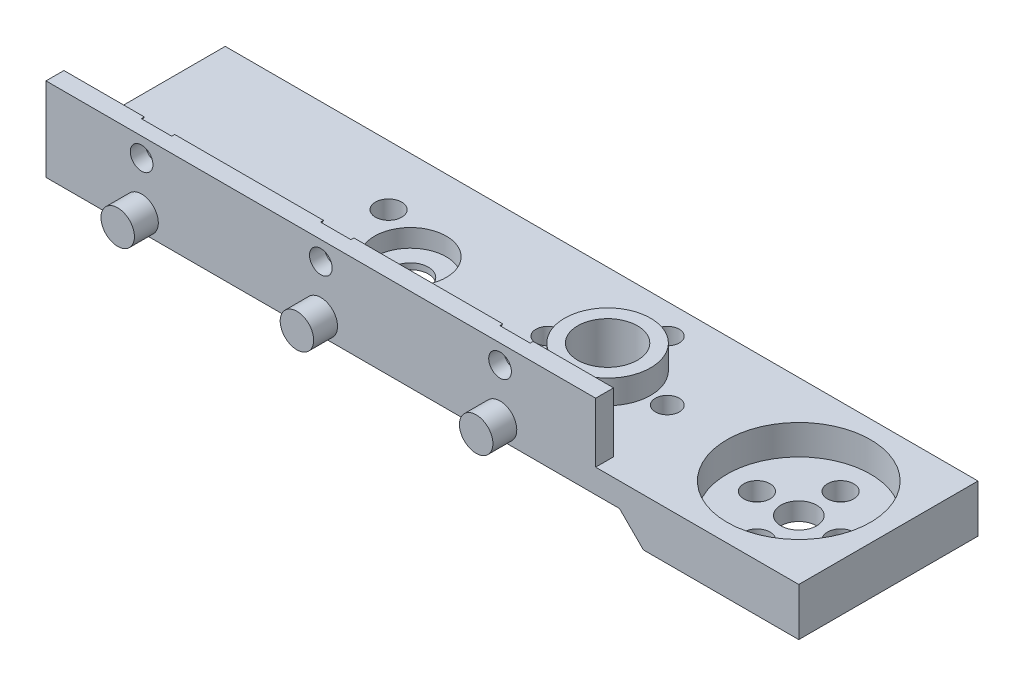
from build123d import *

# Parameters (mm, degrees)
SKETCH_1_W               = 48
SKETCH_1_H               = 15
SKETCH_1_R               = 1.1
SKETCH_1_R_2             = 1
SKETCH_1_R_3             = 1.5
SKETCH_1_R_4             = 2.5
EXTRUDE_1_DEPTH          = 2
EXTRUDE_2_DEPTH          = 2
SKETCH_4_R               = 3
CUT_EXTRUDE_1_DEPTH      = 1.5
SKETCH_5_W               = 46
SKETCH_5_H               = 1.5
EXTRUDE_3_DEPTH          = 5
SKETCH_2_3_R             = 0.95
CUT_EXTRUDE_2_DEPTH      = 6
CUT_EXTRUDE_START        = -0.25
SKETCH_7_R               = 0.95
CUT_EXTRUDE_3_DEPTH      = 0.25
SKETCH_1_3_W             = 15
SKETCH_1_3_H             = 15
SKETCH_1_3_R             = 6
SKETCH_1_3_R_2           = 1.5
SKETCH_1_3_R_3           = 1.1
EXTRUDE_4_DEPTH          = 2
EXTRUDE_START            = -2
SKETCH_1_4_W             = 15
SKETCH_1_4_H             = 15
SKETCH_1_4_R             = 6
SKETCH_1_4_R_2           = 1.5
SKETCH_1_4_R_3           = 1.1
EXTRUDE_5_DEPTH          = 2
CUT_EXTRUDE_4_DEPTH      = 2
CUT_EXTRUDE_4_DEPTH_BACK = 0.5
SKETCH_1_5_R             = 6
CUT_EXTRUDE_5_DEPTH      = 15
SKETCH_9_R               = 3.6
SKETCH_9_R_2             = 2.5
EXTRUDE_6_DEPTH          = 2


with BuildPart() as part:
    # 草图1 → 凸台-拉伸1 (new body)
    with BuildSketch(Plane(origin=(0, 0, 0), x_dir=(1, 0, 0), z_dir=(0, 1, 0))):
        with Locations((-7.5, 0)):
            Rectangle(SKETCH_1_W, SKETCH_1_H)
        with Locations(Location((-4.169872981, -2.5, 0), (0, 0, 270))):
            Circle(SKETCH_1_R, mode=Mode.SUBTRACT)
        with Locations(Location((3, 0, 0), (0, 0, 270))):
            Circle(SKETCH_1_R_2, mode=Mode.SUBTRACT)
        with Locations(Location((-8.5, 0, 0), (0, 0, 270))):
            Circle(SKETCH_1_R_3, mode=Mode.SUBTRACT)
        with Locations(Location((-12.830127019, 2.5, 0), (0, 0, 270))):
            Circle(SKETCH_1_R, mode=Mode.SUBTRACT)
        with Locations(Location((8, 0, 0), (0, 0, 270))):
            Circle(SKETCH_1_R_4, mode=Mode.SUBTRACT)
        with Locations(Location((13, 0, 0), (0, 0, 270))):
            Circle(SKETCH_1_R_2, mode=Mode.SUBTRACT)
        with Locations(Location((8, 5, 0), (0, 0, 270))):
            Circle(SKETCH_1_R_2, mode=Mode.SUBTRACT)
    extrude(amount=EXTRUDE_1_DEPTH)

    # 草图2 → 凸台-拉伸2 (add)
    with BuildSketch(Plane.XY.offset(7.5)):
        with BuildLine():
            Line((-22.1, 1.4), (-24.9, 1.4))
            ThreePointArc((-24.9, 1.4), (-23.5, 0), (-22.1, 1.4))
        make_face()
        with BuildLine():
            ThreePointArc((-24.764911064, 2), (-24.865810289, 1.707509764), (-24.9, 1.4))
            Line((-24.9, 1.4), (-22.1, 1.4))
            ThreePointArc((-22.1, 1.4), (-22.134189711, 1.707509764), (-22.235088936, 2))
            Line((-22.235088936, 2), (-24.764911064, 2))
        make_face()
        with BuildLine():
            ThreePointArc((-22.235088936, 2), (-23.5, 2.8), (-24.764911064, 2))
            Line((-24.764911064, 2), (-22.235088936, 2))
        make_face()
        with BuildLine():
            Line((-7.1, 1.4), (-9.9, 1.4))
            ThreePointArc((-9.9, 1.4), (-8.5, 0), (-7.1, 1.4))
        make_face()
        with BuildLine():
            ThreePointArc((-9.764911064, 2), (-9.865810289, 1.707509764), (-9.9, 1.4))
            Line((-9.9, 1.4), (-7.1, 1.4))
            ThreePointArc((-7.1, 1.4), (-7.134189711, 1.707509764), (-7.235088936, 2))
            Line((-7.235088936, 2), (-9.764911064, 2))
        make_face()
        with BuildLine():
            ThreePointArc((-7.235088936, 2), (-8.5, 2.8), (-9.764911064, 2))
            Line((-9.764911064, 2), (-7.235088936, 2))
        make_face()
        with BuildLine():
            Line((7.9, 1.4), (5.1, 1.4))
            ThreePointArc((5.1, 1.4), (6.5, 0), (7.9, 1.4))
        make_face()
        with BuildLine():
            ThreePointArc((5.235088936, 2), (5.134189711, 1.707509764), (5.1, 1.4))
            Line((5.1, 1.4), (7.9, 1.4))
            ThreePointArc((7.9, 1.4), (7.865810289, 1.707509764), (7.764911064, 2))
            Line((7.764911064, 2), (5.235088936, 2))
        make_face()
        with BuildLine():
            ThreePointArc((7.764911064, 2), (6.5, 2.8), (5.235088936, 2))
            Line((5.235088936, 2), (7.764911064, 2))
        make_face()
    extrude(amount=EXTRUDE_2_DEPTH)

    # 草图4 → 切除-拉伸1 (cut)
    with BuildSketch(Plane(origin=(0, 2, 0), x_dir=(1, 0, 0), z_dir=(0, 1, 0))):
        with Locations(Location((-8.5, 0, 0), (0, 0, 270))):
            Circle(SKETCH_4_R)
    extrude(amount=-CUT_EXTRUDE_1_DEPTH, mode=Mode.SUBTRACT)

    # 草图5 → 凸台-拉伸3 (add)
    with BuildSketch(Plane(origin=(0, 2, 0), x_dir=(1, 0, 0), z_dir=(0, 1, 0))):
        with Locations((-8.5, -6.75)):
            Rectangle(SKETCH_5_W, SKETCH_5_H)
    extrude(amount=EXTRUDE_3_DEPTH)

    # 草图2<3> → 切除-拉伸2 (cut)
    with BuildSketch(Plane.XY.offset(7.5)):
        with Locations((-23.5, 5.4)):
            Circle(SKETCH_2_3_R)
        with Locations((-8.5, 5.4)):
            Circle(SKETCH_2_3_R)
        with Locations((6.5, 5.4)):
            Circle(SKETCH_2_3_R)
    extrude(amount=-CUT_EXTRUDE_2_DEPTH, mode=Mode.SUBTRACT)

    # 草图7 → 切除-拉伸3 (cut)
    # profile 1 of 3: a face of its own
    with BuildSketch(Plane(origin=(0, 0, 6), x_dir=(-1, 0, 0), z_dir=(0, 0, -1)).offset(CUT_EXTRUDE_START)):
        Polygon((-7.596965511, 3.5), (-5.403034489, 3.5), (-4.306068977, 5.4), (-5.403034489, 7.3), (-7.596965511, 7.3), (-8.693931023, 5.4), align=None)
        with Locations(Location((-6.5, 5.4, 0), (0, 0, 180))):
            Circle(SKETCH_7_R, mode=Mode.SUBTRACT)
    # profile 2 of 3: a face of its own
    with BuildSketch(Plane(origin=(0, 0, 6), x_dir=(-1, 0, 0), z_dir=(0, 0, -1)).offset(CUT_EXTRUDE_START)):
        Polygon((6.306068977, 5.4), (7.403034489, 3.5), (9.596965511, 3.5), (10.693931023, 5.4), (9.596965511, 7.3), (7.403034489, 7.3), align=None)
        with Locations(Location((8.5, 5.4, 0), (0, 0, 180))):
            Circle(SKETCH_7_R, mode=Mode.SUBTRACT)
    # profile 3 of 3: a face of its own
    with BuildSketch(Plane(origin=(0, 0, 6), x_dir=(-1, 0, 0), z_dir=(0, 0, -1)).offset(CUT_EXTRUDE_START)):
        Polygon((21.306068977, 5.4), (22.403034489, 3.5), (24.596965511, 3.5), (25.693931023, 5.4), (24.596965511, 7.3), (22.403034489, 7.3), align=None)
    extrude(amount=CUT_EXTRUDE_3_DEPTH, mode=Mode.SUBTRACT)

    # 草图1<3> → 凸台-拉伸4 (add)
    # profile 1 of 2: a face of its own
    with BuildSketch(Plane(origin=(0, 0, 0), x_dir=(1, 0, 0), z_dir=(0, 1, 0))):
        with Locations((24, 0)):
            Rectangle(SKETCH_1_3_W, SKETCH_1_3_H)
        with Locations((24, 0)):
            Circle(SKETCH_1_3_R, mode=Mode.SUBTRACT)
    # profile 2 of 2: a face of its own
    with BuildSketch(Plane(origin=(0, 0, 0), x_dir=(1, 0, 0), z_dir=(0, 1, 0))):
        with Locations((24, 0)):
            Circle(SKETCH_1_3_R)
        with Locations(Location((24, 0, 0), (0, 0, 270))):
            Circle(SKETCH_1_3_R_2, mode=Mode.SUBTRACT)
        with Locations(Location((27.5, 0, 0), (0, 0, 270))):
            Circle(SKETCH_1_3_R_3, mode=Mode.SUBTRACT)
        with Locations(Location((24, -3.5, 0), (0, 0, 270))):
            Circle(SKETCH_1_3_R_3, mode=Mode.SUBTRACT)
        with Locations(Location((20.5, 0, 0), (0, 0, 270))):
            Circle(SKETCH_1_3_R_3, mode=Mode.SUBTRACT)
        with Locations(Location((24, 3.5, 0), (0, 0, 270))):
            Circle(SKETCH_1_3_R_3, mode=Mode.SUBTRACT)
    extrude(amount=EXTRUDE_4_DEPTH)

    # 草图1<4> → 凸台-拉伸5 (add)
    # profile 1 of 2: a face of its own
    with BuildSketch(Plane(origin=(0, 0, 0), x_dir=(1, 0, 0), z_dir=(0, 1, 0)).offset(EXTRUDE_START)):
        with Locations((24, 0)):
            Rectangle(SKETCH_1_4_W, SKETCH_1_4_H)
        with Locations((24, 0)):
            Circle(SKETCH_1_4_R, mode=Mode.SUBTRACT)
    # profile 2 of 2: a face of its own
    with BuildSketch(Plane(origin=(0, 0, 0), x_dir=(1, 0, 0), z_dir=(0, 1, 0)).offset(EXTRUDE_START)):
        with Locations((24, 0)):
            Circle(SKETCH_1_4_R)
        with Locations(Location((24, 0, 0), (0, 0, 270))):
            Circle(SKETCH_1_4_R_2, mode=Mode.SUBTRACT)
        with Locations(Location((27.5, 0, 0), (0, 0, 270))):
            Circle(SKETCH_1_4_R_3, mode=Mode.SUBTRACT)
        with Locations(Location((24, -3.5, 0), (0, 0, 270))):
            Circle(SKETCH_1_4_R_3, mode=Mode.SUBTRACT)
        with Locations(Location((20.5, 0, 0), (0, 0, 270))):
            Circle(SKETCH_1_4_R_3, mode=Mode.SUBTRACT)
        with Locations(Location((24, 3.5, 0), (0, 0, 270))):
            Circle(SKETCH_1_4_R_3, mode=Mode.SUBTRACT)
    extrude(amount=EXTRUDE_5_DEPTH)

    # 草图1<5> → 切除-拉伸4 (cut, two sides: drawn at the far end of the back side and taken through both)
    with BuildSketch(Plane(origin=(0, 0, 0), x_dir=(1, 0, 0), z_dir=(0, 1, 0)).offset(-CUT_EXTRUDE_4_DEPTH_BACK)):
        with Locations(Location((24, 0, 0), (0, 0, 270))):
            Circle(SKETCH_1_5_R)
    extrude(amount=CUT_EXTRUDE_4_DEPTH + CUT_EXTRUDE_4_DEPTH_BACK, mode=Mode.SUBTRACT)

    # 草图8 → 切除-拉伸5 (cut)
    with BuildSketch(Plane(origin=(0, 0, -7.5), x_dir=(-1, 0, 0), z_dir=(0, 0, -1))):
        Polygon((-16.5, 0), (-18.5, -2), (-16.5, -2), align=None)
    extrude(amount=-CUT_EXTRUDE_5_DEPTH, mode=Mode.SUBTRACT)

    # 草图9 → 凸台-拉伸6 (add)
    with BuildSketch(Plane(origin=(0, 2, 0), x_dir=(1, 0, 0), z_dir=(0, 1, 0))):
        with Locations(Location((8, 0, 0), (0, 0, 270))):
            Circle(SKETCH_9_R)
        with Locations(Location((8, 0, 0), (0, 0, 270))):
            Circle(SKETCH_9_R_2, mode=Mode.SUBTRACT)
    extrude(amount=EXTRUDE_6_DEPTH)


solid = part.part
